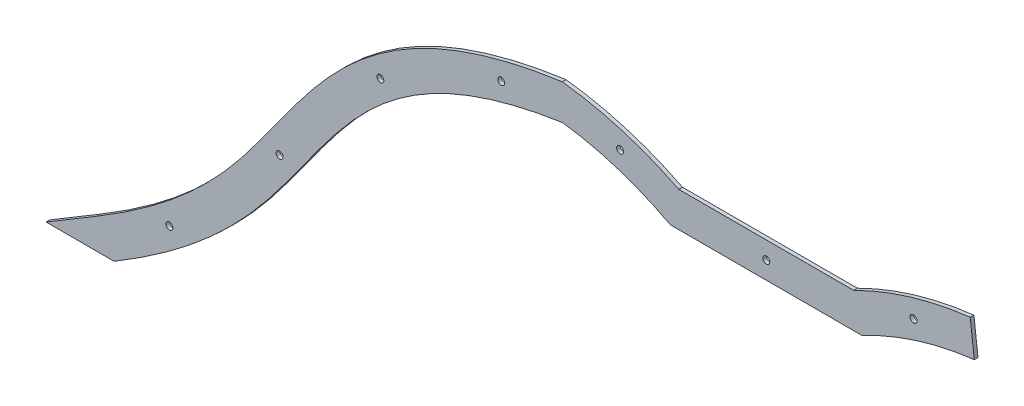
from build123d import *

# Parameters (mm, degrees)
SKETCH1_R           = 3
BOSS_EXTRUDE1_DEPTH = 3.175


with BuildPart() as part:
    # Sketch1 → Boss-Extrude1 (new body)
    with BuildSketch(Plane.XY):
        with BuildLine():
            Line((25, 170), (175, 170))
            ThreePointArc((175, 170), (223.684930832, 189.383563894), (275, 200))
            Line((275, 200), (278.48892965, 170.203567833))
            ThreePointArc((278.48892965, 170.203567833), (228.984362684, 159.629140364), (182.323699215, 140))
            Line((182.323699215, 140), (17.676300785, 140))
            ThreePointArc((17.676300785, 140), (-27.163176857, 159.050053662), (-74.696057289, 169.732215313))
            add(Edge.make_bspline(
                [(-459.597813184, -125.74437106), (-458.167847661, -124.888859924), (-455.300989911, -123.160410804), (-449.693031194, -119.725805066), (-442.844497858, -115.430194443), (-434.897527213, -110.280573748), (-424.643042919, -103.410605598), (-412.446207366, -94.807407336), (-398.73286692, -84.425459971), (-385.875530014, -73.956655832), (-369.787206696, -59.850046206), (-355.152571956, -45.476802835), (-341.718077927, -30.784744771), (-332.160906415, -19.581186548), (-323.101555816, -8.241034683), (-311.630816912, 6.863649777), (-298.117522758, 25.605990916), (-282.395742384, 47.431562205), (-266.384320483, 68.25099024), (-249.34123977, 87.803395961), (-230.504956306, 105.928130356), (-212.601243201, 119.774018212), (-196.457396921, 130.048920131), (-183.303935629, 137.33205425), (-168.969219752, 144.162376514), (-153.317967868, 150.50005901), (-136.218766867, 156.296597686), (-120.658812709, 160.629761276), (-107.364076993, 163.767973943), (-96.958515184, 165.949209965), (-87.903435435, 167.618170459), (-80.445251901, 168.856738216), (-76.604810273, 169.448930821), (-74.696057289, 169.732215313)],
                knots=[0, 0, 0, 0, 0.007772041, 0.015544083, 0.031088165, 0.046632248, 0.06217633, 0.093264496, 0.124352661, 0.155440826, 0.186528991, 0.248705321, 0.279793487, 0.310881652, 0.341969817, 0.373057982, 0.435234312, 0.497410643, 0.559586973, 0.621763303, 0.683939634, 0.746115964, 0.777204129, 0.808292294, 0.83938046, 0.870468625, 0.90155679, 0.932644955, 0.948189038, 0.96373312, 0.979277203, 0.987049244, 0.994821285, 0.994821285, 0.994821285, 0.994821285], degree=3))
            Line((-459.597813184, -125.74437106), (-518.031074044, -125.74437106))
            Line((-518.031074044, -125.74437106), (-475, -100))
            add(Edge.make_bspline(
                [(-475, -100), (-419.540575809, -66.820070684), (-306.013905785, 34.036801702), (-257.635554762, 174.287094016), (-75, 200)],
                knots=[0, 0, 0, 0, 0.312223899, 1, 1, 1, 1], degree=3))
            ThreePointArc((-75, 200), (-23.684930832, 189.383563894), (25, 170))
        make_face()
        with Locations((-412.174499428, -75.74437106)):
            Circle(SKETCH1_R, mode=Mode.SUBTRACT)
        with Locations((-317.601811803, 24.25562894)):
            Circle(SKETCH1_R, mode=Mode.SUBTRACT)
        with Locations((-231.096695012, 124.25562894)):
            Circle(SKETCH1_R, mode=Mode.SUBTRACT)
        with Locations((-127.411512689, 174.25562894)):
            Circle(SKETCH1_R, mode=Mode.SUBTRACT)
        with Locations((100, 155)):
            Circle(SKETCH1_R, mode=Mode.SUBTRACT)
        with Locations((226.311251147, 174.505328628)):
            Circle(SKETCH1_R, mode=Mode.SUBTRACT)
        with Locations((-25.392583218, 174.221837866)):
            Circle(SKETCH1_R, mode=Mode.SUBTRACT)
    extrude(amount=BOSS_EXTRUDE1_DEPTH)


solid = part.part
